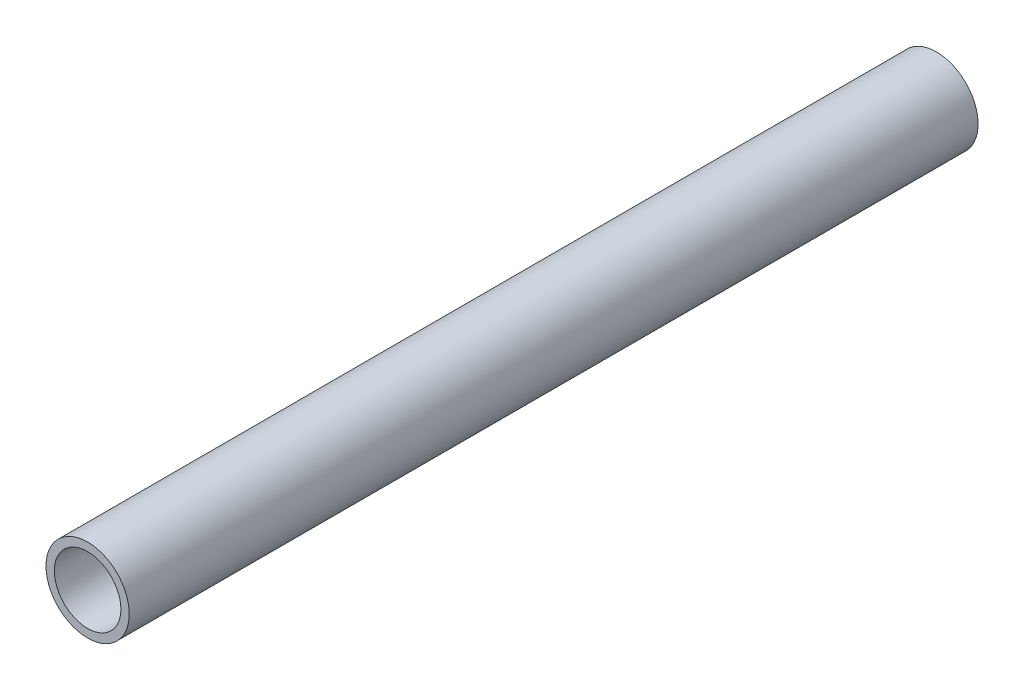
from build123d import *

# Parameters (mm, degrees)
SKETCH1_R           = 5
SKETCH1_R_2         = 4
BOSS_EXTRUDE1_DEPTH = 100
BOSS_EXTRUDE2_START = 2
SKETCH6_R           = 5
BOSS_EXTRUDE2_DEPTH = 2


with BuildPart() as part:
    # Sketch1 → Boss-Extrude1 (new body)
    with BuildSketch(Plane.XY):
        Circle(SKETCH1_R)
        Circle(SKETCH1_R_2, mode=Mode.SUBTRACT)
    extrude(amount=BOSS_EXTRUDE1_DEPTH)

    # Sketch6 → Boss-Extrude2 (add)
    with BuildSketch(Plane(origin=(0, 0, 0), x_dir=(-1, 0, 0), z_dir=(0, 0, -1)).offset(BOSS_EXTRUDE2_START)):
        Circle(SKETCH6_R)
    extrude(amount=-BOSS_EXTRUDE2_DEPTH)


solid = part.part
